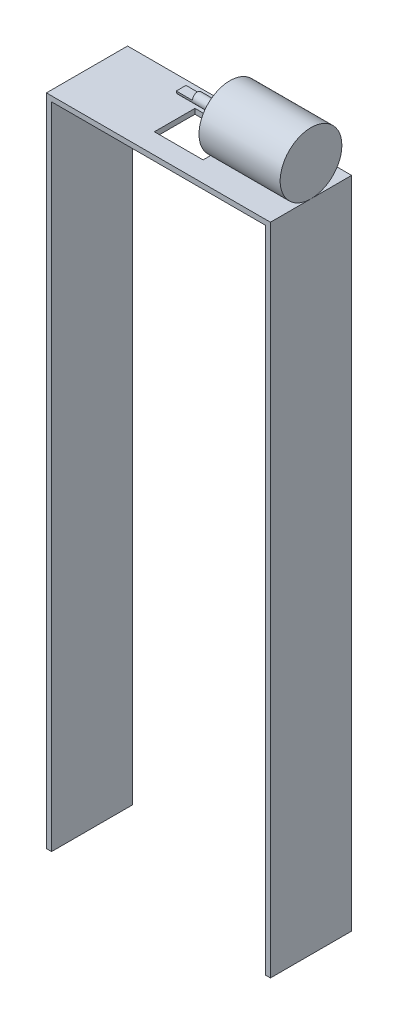
from build123d import *

# Parameters (mm, degrees)
SKETCH2_W             = 3.175
SKETCH2_H             = 50
BOSS_EXTRUDE1_DEPTH   = 400
BOSS_EXTRUDE1_2_DEPTH = 400
SKETCH3_W             = 138
SKETCH3_H             = 50
BOSS_EXTRUDE2_DEPTH   = 3.175
CUT_EXTRUDE1_REACH    = 431.062
SKETCH4_W             = 30
SKETCH4_H             = 25
SKETCH5_R             = 19
BOSS_EXTRUDE3_DEPTH   = 50
SKETCH6_R             = 3
BOSS_EXTRUDE4_DEPTH   = 30
SKETCH7_W             = 6
SKETCH7_H             = 3
CUT_EXTRUDE2_DEPTH    = 10


with BuildPart() as part:
    # Sketch2 → Boss-Extrude1 (new body)
    with BuildSketch(Plane(origin=(0, 0, 0), x_dir=(1, 0, 0), z_dir=(0, 1, 0))):
        with Locations((1.5875, 25)):
            Rectangle(SKETCH2_W, SKETCH2_H)
    extrude(amount=BOSS_EXTRUDE1_DEPTH)



with BuildPart() as body_2:
    # Sketch2 → Boss-Extrude1 2 (new body)
    with BuildSketch(Plane(origin=(0, 0, 0), x_dir=(1, 0, 0), z_dir=(0, 1, 0))):
        with Locations((136.4125, 25)):
            Rectangle(SKETCH2_W, SKETCH2_H)
    extrude(amount=BOSS_EXTRUDE1_2_DEPTH)


with BuildPart() as part_1:
    add(part.part)

    add(body_2.part)  # Boss-Extrude2 merges body 2
    # Sketch3 → Boss-Extrude2 (add)
    with BuildSketch(Plane(origin=(0, 400, 0), x_dir=(1, 0, 0), z_dir=(0, 1, 0))):
        with Locations((69, 25)):
            Rectangle(SKETCH3_W, SKETCH3_H)
    extrude(amount=BOSS_EXTRUDE2_DEPTH)

    # Sketch4 → Cut-Extrude1 (cut, up to next)
    with BuildSketch(Plane(origin=(0, 403.175, 0), x_dir=(1, 0, 0), z_dir=(0, 1, 0)), mode=Mode.PRIVATE) as cut_extrude1_sk1:
        with Locations((69, 25)):
            Rectangle(SKETCH4_W, SKETCH4_H)
    cut_extrude1_tool1 = extrude(cut_extrude1_sk1.sketch, amount=-CUT_EXTRUDE1_REACH, mode=Mode.PRIVATE) & part_1.part
    add(cut_extrude1_tool1.solids().sort_by_distance((69, 403.175, -25))[0], mode=Mode.SUBTRACT)


with BuildPart() as body_2_2:
    # Sketch5 → Boss-Extrude3 (new body)
    with BuildSketch(Plane(origin=(138, 0, 0), x_dir=(0, 0, -1), z_dir=(1, 0, 0))):
        with Locations((25, 422.175)):
            Circle(SKETCH5_R)
    extrude(amount=-BOSS_EXTRUDE3_DEPTH)

    # Sketch6 → Boss-Extrude4 (add)
    with BuildSketch(Plane.ZY.offset(-88)):
        with Locations((-25, 422.175)):
            Circle(SKETCH6_R)
    extrude(amount=BOSS_EXTRUDE4_DEPTH)

    # Sketch7 → Cut-Extrude2 (cut)
    with BuildSketch(Plane.ZY.offset(-58)):
        with Locations((-25, 423.675)):
            Rectangle(SKETCH7_W, SKETCH7_H)
    extrude(amount=-CUT_EXTRUDE2_DEPTH, mode=Mode.SUBTRACT)


solid = Compound([part_1.part, body_2_2.part])
